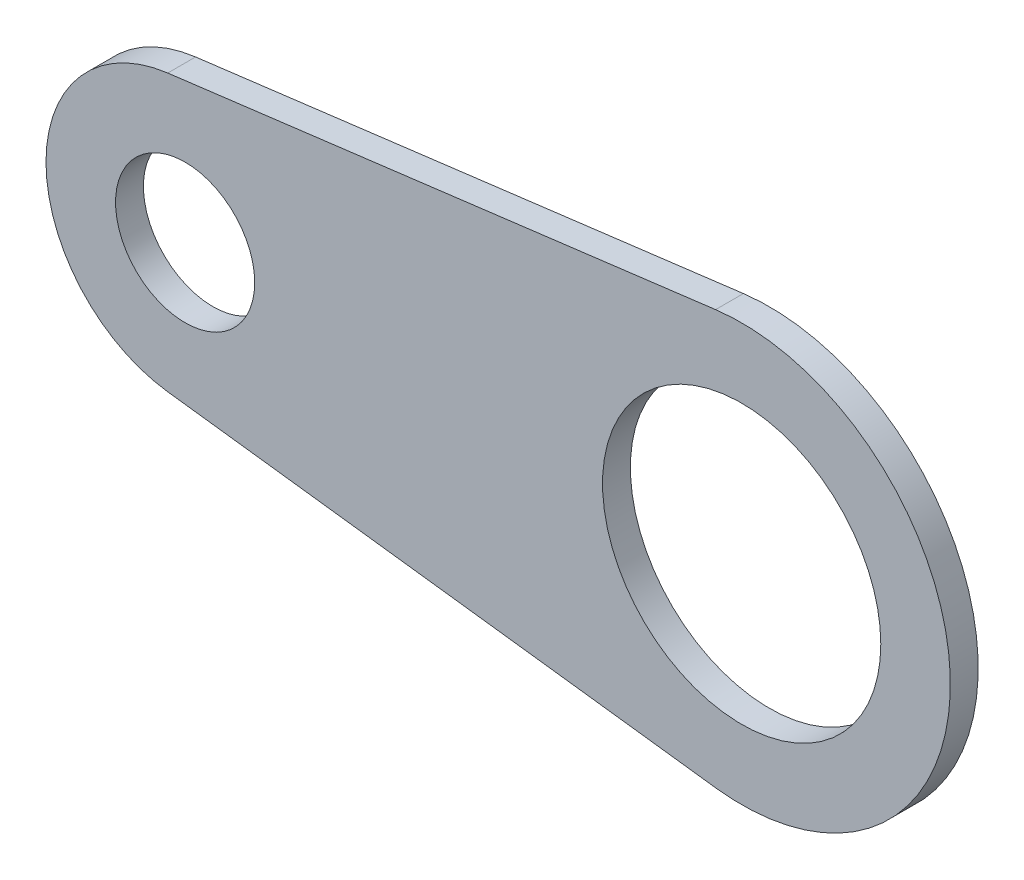
from build123d import *

# Parameters (mm, degrees)
SKETCH_1_R      = 5
SKETCH_1_R_2    = 2.5
EXTRUDE_1_DEPTH = 1


with BuildPart() as part:
    # Эскиз1 → Бобышка-Вытянуть1 (new body)
    with BuildSketch(Plane.XY):
        with BuildLine():
            Line((-0.9375, 7.441175562), (-20.625, 4.960783708))
            ThreePointArc((-20.625, 4.960783708), (-25, 0), (-20.625, -4.960783708))
            Line((-20.625, -4.960783708), (-0.9375, -7.441175562))
            ThreePointArc((-0.9375, -7.441175562), (7.5, 0), (-0.9375, 7.441175562))
        make_face()
        Circle(SKETCH_1_R, mode=Mode.SUBTRACT)
        with Locations((-20, 0)):
            Circle(SKETCH_1_R_2, mode=Mode.SUBTRACT)
    extrude(amount=EXTRUDE_1_DEPTH)


solid = part.part
